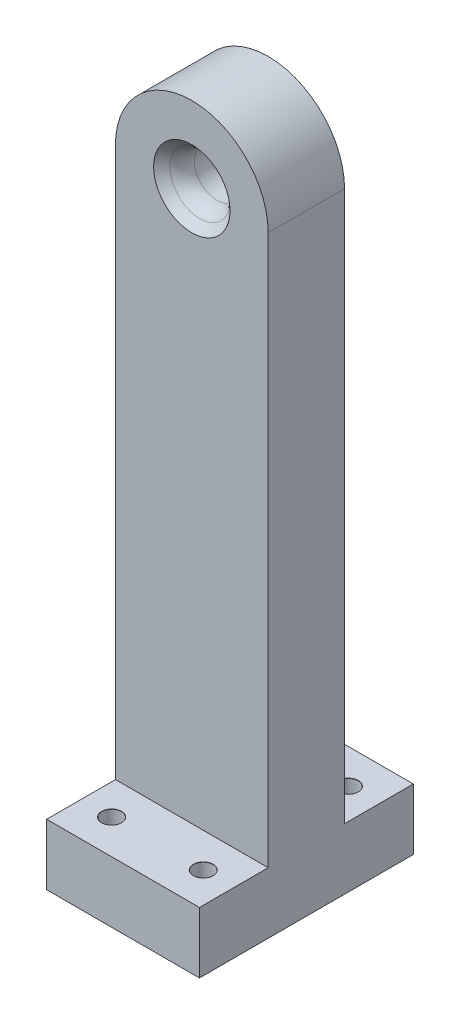
from build123d import *

# Parameters (mm, degrees)
SKETCH1_R                            = 3.75
BOSS_EXTRUDE1_DEPTH                  = 35
SKETCH5_W                            = 11.25
SKETCH5_H                            = 102.5
CUT_EXTRUDE1_DEPTH                   = 121.441894704
F_3_2_3_2_DIAMETER_HOLE1_D           = 3.2
F_3_2_3_2_DIAMETER_HOLE1_CSINK_D     = 3.25
F_3_2_3_2_DIAMETER_HOLE1_CSINK_ANGLE = 90
CHAMFER1_SIZE                        = 2.5
FILLET1_R                            = 4


with BuildPart() as part:
    # Sketch1 → Boss-Extrude1 (new body)
    with BuildSketch(Plane.XY):
        with BuildLine():
            Line((0, 0), (-12.5, 0))
            Line((-12.5, 0), (-12.5, 100))
            ThreePointArc((-12.5, 100), (0, 112.5), (12.5, 100))
            Line((12.5, 100), (12.5, 0))
            Line((12.5, 0), (0, 0))
        make_face()
        with Locations((0, 100)):
            Circle(SKETCH1_R, mode=Mode.SUBTRACT)
    extrude(amount=BOSS_EXTRUDE1_DEPTH)

    # Sketch5 → Cut-Extrude1 (cut, through all)
    with BuildSketch(Plane(origin=(12.5, 0, 0), x_dir=(0, 0, -1), z_dir=(1, 0, 0))):
        with Locations((-29.375, 61.25)):
            Rectangle(SKETCH5_W, SKETCH5_H)
        with Locations((-5.625, 61.25)):
            Rectangle(SKETCH5_W, SKETCH5_H)
    extrude(amount=-CUT_EXTRUDE1_DEPTH, mode=Mode.SUBTRACT)

    # Ø3.2 (3.2) Diameter Hole1 (through all)
    with Locations(Plane(origin=(0, 10, 0), x_dir=(1, 0, 0), z_dir=(0, 1, 0))):
        with Locations((-7.5, -5.625), (7.5, -5.625), (7.5, -29.375), (-7.5, -29.375)):
            CounterSinkHole(F_3_2_3_2_DIAMETER_HOLE1_D / 2, F_3_2_3_2_DIAMETER_HOLE1_CSINK_D / 2, counter_sink_angle=F_3_2_3_2_DIAMETER_HOLE1_CSINK_ANGLE)

    # Chamfer1
    chamfer1_edges = [part.edges().sort_by_distance(p)[0] for p in [
        (-3.75, 100, 23.75),
    ]]
    chamfer(chamfer1_edges, length=CHAMFER1_SIZE)

    # Fillet1
    fillet1_edges = [part.edges().sort_by_distance(p)[0] for p in [
        (-3.75, 100, 21.25),
    ]]
    fillet(fillet1_edges, radius=FILLET1_R)


solid = part.part
